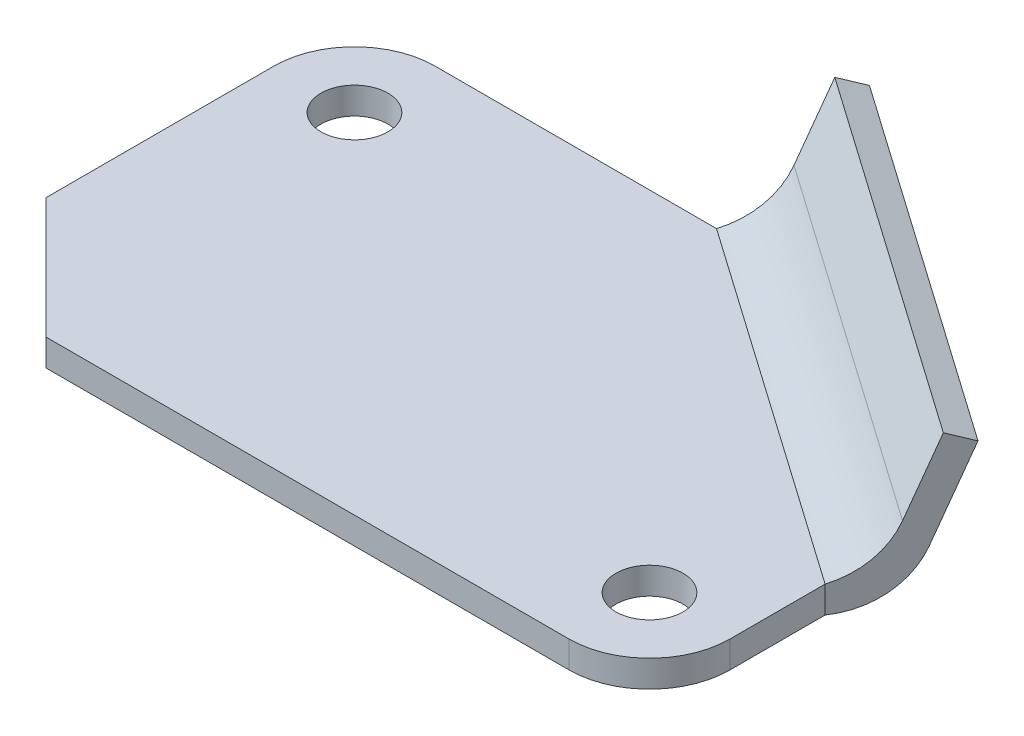
from build123d import *

# Parameters (mm, degrees)
SKETCH2_R           = 5
BOSS_EXTRUDE1_DEPTH = 4
BOSS_EXTRUDE2_DEPTH = 65.921828


with BuildPart() as part:
    # Sketch2 → Boss-Extrude1 (new body)
    with BuildSketch(Plane(origin=(0, 0, 0), x_dir=(1, 0, 0), z_dir=(0, 1, 0))):
        with BuildLine():
            Line((0, 32), (-42, 32))
            ThreePointArc((-42, 32), (-50.485281374, 28.485281374), (-54, 20))
            Line((-54, 20), (-54, -14))
            Line((-54, -14), (-36, -32))
            Line((-36, -32), (42, -32))
            ThreePointArc((42, -32), (50.485281374, -28.485281374), (54, -20))
            Line((54, -20), (54, -5.811207063))
            Line((54, -5.811207063), (0, 32))
        make_face()
        with Locations(Location((-42, 20, 0), (0, 0, 270))):
            Circle(SKETCH2_R, mode=Mode.SUBTRACT)
        with Locations(Location((42, -20, 0), (0, 0, 270))):
            Circle(SKETCH2_R, mode=Mode.SUBTRACT)
    extrude(amount=BOSS_EXTRUDE1_DEPTH)


with BuildPart() as body_2:
    # Sketch3 → Boss-Extrude2 (new body)
    with BuildSketch(Plane(origin=(38.964918067, 0, 27.283529357), x_dir=(0, -1, 0), z_dir=(0.8191520442889951, 0, 0.5735764363510414))):
        with BuildLine():
            Line((-11.16495341, 34.503762636), (-21.983721217, 38.874828562))
            Line((-21.983721217, 38.874828562), (-20.485294843, 42.58356398))
            Line((-20.485294843, 42.58356398), (-7.504720879, 37.339071672))
            ThreePointArc((-7.504720879, 37.339071672), (-2.051549129, 32.923180259), (0, 26.212865417))
            Line((0, 26.212865417), (-4, 26.212865417))
            ThreePointArc((-4, 26.212865417), (-6.580866729, 31.223900539), (-11.16495341, 34.503762636))
        make_face()
    extrude(amount=-BOSS_EXTRUDE2_DEPTH)


solid = Compound([part.part, body_2.part])
